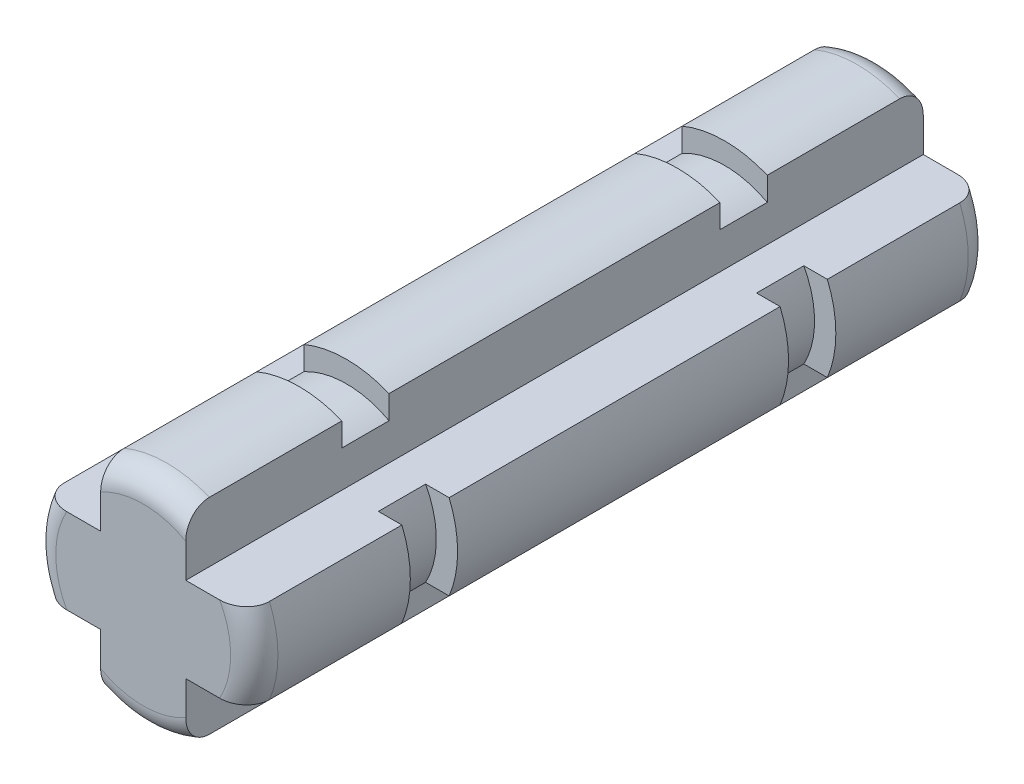
from build123d import *

# Parameters (mm, degrees)
BOSS_EXTRUDE1_DEPTH = 7.8
FILLET1_R           = 0.5
SIDE_START          = 3.5
SKETCH2_OUTSIDE_W   = 10.092
SKETCH2_OUTSIDE_H   = 10.092
SKETCH2_OUTSIDE_R   = 1.9
SIDE_CUT_DEPTH      = 1


with BuildPart() as part:
    # Sketch1 → Boss-Extrude1 (new, symmetric)
    with BuildSketch(Plane.XY):
        with BuildLine():
            Line((-0.9000000000000004, 0.9), (0.8999999999999999, 0.9000000000000002))
            Line((0.8999999999999998, 0.9000000000000004), (0.8999999999999998, 2.1708293346092873))
            ThreePointArc((0.8999999999999373, 2.170829334609268), (0.45883061344477144, 2.3047721076422936), (-1.386e-14, 2.3500000000000014))
            ThreePointArc((-1.386e-14, 2.3500000000000014), (-0.45883061344483045, 2.3047721076422825), (-0.9000000000000228, 2.170829334609233))
            Line((-0.9000000000000002, 2.170829334609226), (-0.9000000000000002, 0.8999999999999999))
        make_face()
        with BuildLine():
            Line((0.8999999999999998, 0.9000000000000004), (0.8999999999999998, -0.8999999999999999))
            Line((0.8999999999999999, -0.8999999999999998), (2.170829334609184, -0.8999999999999996))
            ThreePointArc((2.170829334609208, -0.9000000000000794), (2.304772107642276, -0.4588306134448533), (2.35, 2.9e-16))
            ThreePointArc((2.35, 8.7e-16), (2.3047721076422767, 0.4588306134448523), (2.1708293346092096, 0.9000000000000766))
            Line((2.170829334609186, 0.9000000000000004), (0.8999999999999999, 0.9000000000000002))
        make_face()
        with BuildLine():
            ThreePointArc((-0.9000000000000248, -2.1708293346092304), (-0.4588306134448299, -2.3047721076422807), (-1.13e-14, -2.3499999999999996))
            ThreePointArc((-1.13e-14, -2.3499999999999996), (0.45883061344477294, -2.304772107642292), (0.8999999999999382, -2.170829334609266))
            Line((0.8999999999999998, -2.1708293346092846), (0.8999999999999998, -0.8999999999999999))
            Line((0.8999999999999999, -0.8999999999999998), (-0.9000000000000004, -0.8999999999999999))
            Line((-0.9000000000000002, -0.8999999999999999), (-0.9000000000000002, -2.1708293346092233))
        make_face()
        with BuildLine():
            Line((-2.1708293346092815, -0.9000000000000001), (-0.9000000000000004, -0.8999999999999999))
            Line((-0.9000000000000002, -0.8999999999999999), (-0.9000000000000002, 0.8999999999999999))
            Line((-0.9000000000000004, 0.9), (-2.1708293346092815, 0.8999999999999999))
            ThreePointArc((-2.170829334609265, 0.8999999999999461), (-2.3047721076422913, 0.45883061344478315), (-2.350000000000001, 1.16e-15))
            ThreePointArc((-2.350000000000001, 1.16e-15), (-2.3047721076422913, -0.4588306134447819), (-2.170829334609264, -0.8999999999999455))
        make_face()
        Polygon((-0.9000000000000004, -0.8999999999999999), (0.8999999999999999, -0.8999999999999998), (0.8999999999999998, 0.9000000000000004), (-0.9000000000000004, 0.9), align=None)
    extrude(amount=BOSS_EXTRUDE1_DEPTH, both=True)

    # Fillet1
    fillet1_edges = [part.edges().sort_by_distance(p)[0] for p in [
        (-2.955e-14, 2.3500000000000014, 7.8),
        (2.3500000000000005, -9.3e-16, -7.8),
        (-2.982e-14, -2.3499999999999996, -7.8),
        (-2.350000000000001, 4.4e-16, -7.8),
        (-2.92e-14, 2.3500000000000014, -7.8),
        (-2.350000000000001, 2.2e-16, 7.8),
        (-2.943e-14, -2.3499999999999996, 7.8),
        (2.3499999999999996, -4.6e-16, 7.8),
    ]]
    fillet(fillet1_edges, radius=FILLET1_R)

    # Sketch2 outside → Side Cut (cut)
    with BuildSketch(Plane.XY.offset(SIDE_START)):
        Rectangle(SKETCH2_OUTSIDE_W, SKETCH2_OUTSIDE_H)
        Circle(SKETCH2_OUTSIDE_R, mode=Mode.SUBTRACT)
    side_cut = extrude(amount=SIDE_CUT_DEPTH, mode=Mode.SUBTRACT)

    # Mirror1: Side Cut across plane
    add(side_cut.mirror(Plane.XY), mode=Mode.SUBTRACT)


solid = part.part
